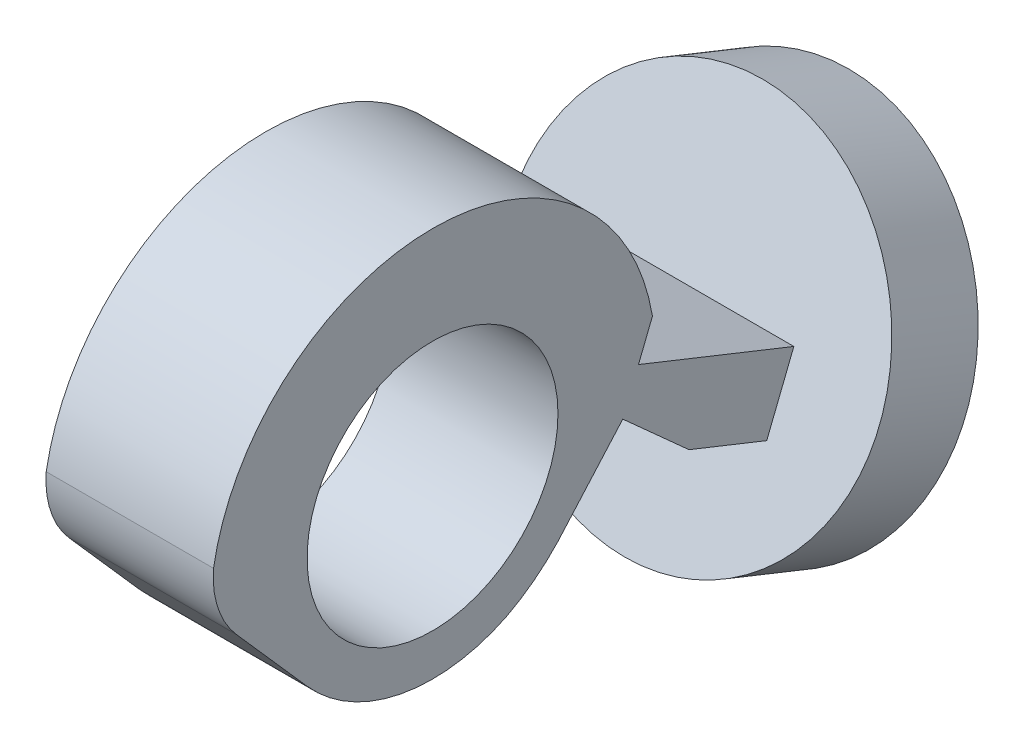
from build123d import *

# Parameters (mm, degrees)
SKETCH1_R           = 6.750001985
BOSS_EXTRUDE1_DEPTH = 9
SKETCH3_R           = 10.000000826
BOSS_EXTRUDE2_DEPTH = 14
SKETCH4_R           = 10.000000826
SKETCH4_W           = 9
SKETCH4_H           = 8.939675258
CUT_EXTRUDE1_DEPTH  = 9
SKETCH5_W           = 9
SKETCH5_H           = 9
CUT_EXTRUDE2_DEPTH  = 3
SKETCH6_W           = 9
SKETCH6_H           = 9
CUT_EXTRUDE4_DEPTH  = 2
CUT_EXTRUDE5_DEPTH  = 10
SKETCH8_W           = 5
SKETCH8_H           = 6
CUT_EXTRUDE6_DEPTH  = 3


with BuildPart() as part:
    # Sketch1 → Boss-Extrude1 (new body)
    with BuildSketch(Plane(origin=(0, 0, 0), x_dir=(0, 0, -1), z_dir=(1, 0, 0))):
        with BuildLine():
            Line((-0.454941956, 12.359391949), (3.344728948, 8.050966095))
            ThreePointArc((3.344728948, 8.050966095), (8.344592491, 5.175709333), (14.063217322, 5.92608719))
            ThreePointArc((14.063217322, 5.92608719), (15.54600466, 6.868056536), (16.844733397, 8.050963212))
            Line((16.844733397, 8.050963212), (20.330899398, 12.003905107))
            Line((20.330899398, 12.003905107), (21.92689244, 16.003905107))
            ThreePointArc((21.92689244, 16.003905107), (10.143848092, 26.003055139), (-1.689188798, 16.063116838))
            ThreePointArc((-1.689188798, 16.063116838), (-1.448481266, 14.085815778), (-0.454941956, 12.359391949))
        make_face()
        with Locations((10.094731316, 14.003903077)):
            Circle(SKETCH1_R, mode=Mode.SUBTRACT)
    extrude(amount=BOSS_EXTRUDE1_DEPTH)

    # Sketch3 → Boss-Extrude2 (add)
    with BuildSketch(Plane(origin=(0, -5.349360366, -13.40697666), x_dir=(-1, 0, 0), z_dir=(0, -0.3705884577579875, -0.9287971764473427))):
        with Locations(Location((-4, 19.907031212, 0), (0, 0, 90))):
            Circle(SKETCH3_R)
    extrude(amount=BOSS_EXTRUDE2_DEPTH)

    # Sketch4 → Cut-Extrude1 (cut)
    with BuildSketch(Plane(origin=(0, -5.349360366, -13.40697666), x_dir=(1, 0, 0), z_dir=(0, 0.3705884577579875, 0.9287971764473427))):
        with Locations(Location((4, 19.907031212, 0), (0, 0, 270))):
            Circle(SKETCH4_R)
        with Locations((4.5, 19.495062719)):
            Rectangle(SKETCH4_W, SKETCH4_H, mode=Mode.SUBTRACT)
    extrude(amount=-CUT_EXTRUDE1_DEPTH, mode=Mode.SUBTRACT)

    # Sketch5 → Cut-Extrude2 (cut)
    with BuildSketch(Plane(origin=(0, 22.258531777, -8.88111546), x_dir=(1, 0, 0), z_dir=(0, 0.9287971764473427, -0.3705884577579875))):
        with Locations((4.5, 18.934773275)):
            Rectangle(SKETCH5_W, SKETCH5_H)
    extrude(amount=-CUT_EXTRUDE2_DEPTH, mode=Mode.SUBTRACT)

    # Sketch6 → Cut-Extrude4 (cut)
    with BuildSketch(Plane(origin=(0, 13.955386639, -5.568174994), x_dir=(1, 0, 0), z_dir=(0, -0.9287971764473427, 0.3705884577579875))):
        with Locations((4.5, -18.934773275)):
            Rectangle(SKETCH6_W, SKETCH6_H)
    extrude(amount=-CUT_EXTRUDE4_DEPTH, mode=Mode.SUBTRACT)

    # Sketch7 → Cut-Extrude5 (cut)
    with BuildSketch(Plane.ZY):
        Polygon((-20.330899398, 12.003905107), (-23.895915863, 8.795972566), (-19.716328569, 10.463620626), align=None)
    extrude(amount=-CUT_EXTRUDE5_DEPTH, mode=Mode.SUBTRACT)

    # Sketch8 → Cut-Extrude6 (cut)
    with BuildSketch(Plane(origin=(0, -10.537598775, -26.41013713), x_dir=(-1, 0, 0), z_dir=(0, -0.3705884577579875, -0.9287971764473427))):
        with Locations((-4, 19.907031212)):
            Rectangle(SKETCH8_W, SKETCH8_H)
    extrude(amount=-CUT_EXTRUDE6_DEPTH, mode=Mode.SUBTRACT)


solid = part.part
